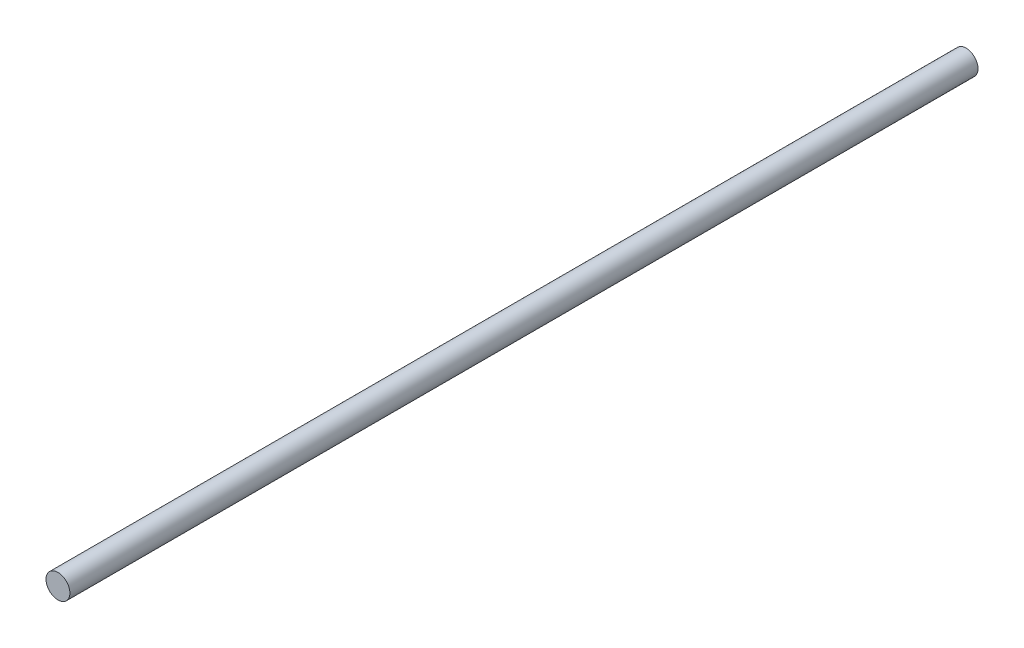
from build123d import *

# Parameters (mm, degrees)
ESQUISSE1_R        = 3.175
BOSS_EXTRU_1_DEPTH = 241.3


with BuildPart() as part:
    # Esquisse1 → Boss.-Extru.1 (new body)
    with BuildSketch(Plane.XY):
        with Locations(Location((0, 0, 0), (0, 0, 180))):
            Circle(ESQUISSE1_R)
    extrude(amount=BOSS_EXTRU_1_DEPTH)


solid = part.part
